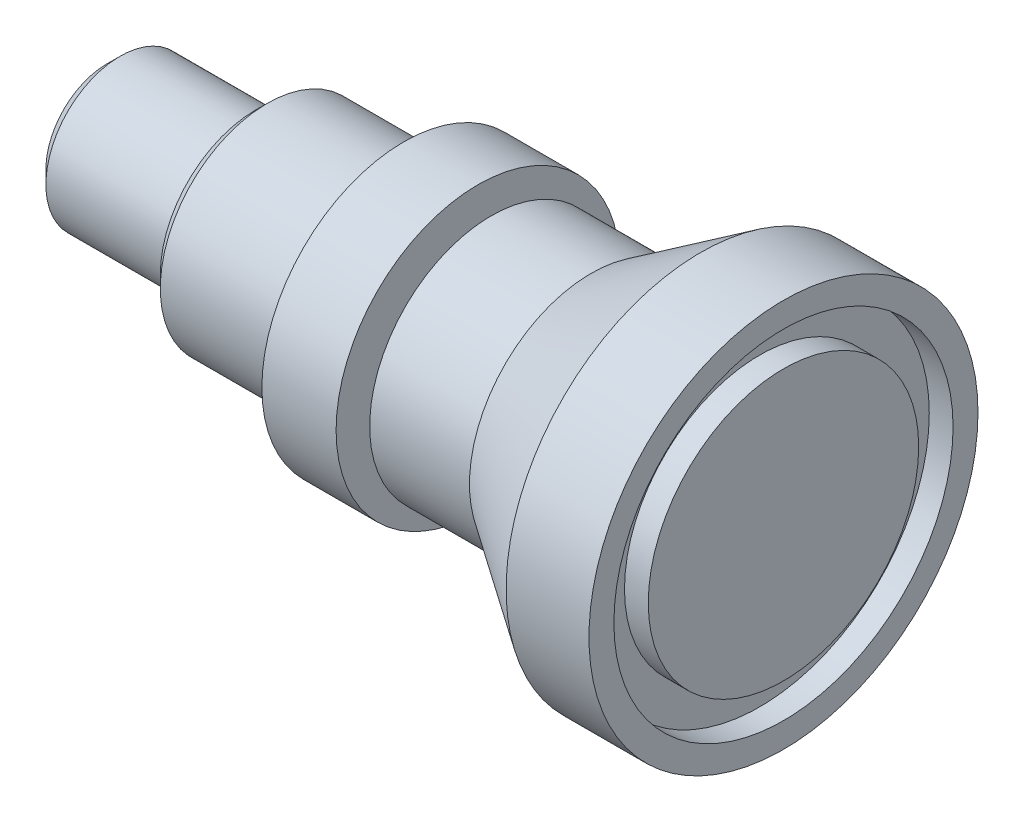
from build123d import *


with BuildPart() as part:
    # Sketch1 → Revolve1 (revolve)
    with BuildSketch(Plane.XY, mode=Mode.PRIVATE) as revolve1_sk:
        Polygon((0, 0), (0, 2.609816754), (0.565183246, 3.175), (6.35, 3.175), (6.35, 4.065863984), (6.856136016, 4.572), (12.7, 4.572), (12.7, 6.069064721), (15.875, 6.069064721), (15.875, 3.175), (16.447553087, 3.175), (16.447553087, 5.20488643), (20.715714832, 5.20488643), (25.401697744, 8.321951742), (28.945950385, 8.321951742), (28.945950385, 7.255276624), (27.928310887, 7.255276624), (27.928310887, 5.784816754), (28.945950385, 5.784816754), (28.945950385, 0), align=None)
    revolve(revolve1_sk.sketch.rotate(Axis((28.945950385, 0, 0), (-1, 0, 0)), 90), axis=Axis((28.945950385, 0, 0), (-1, 0, 0)))


solid = part.part
